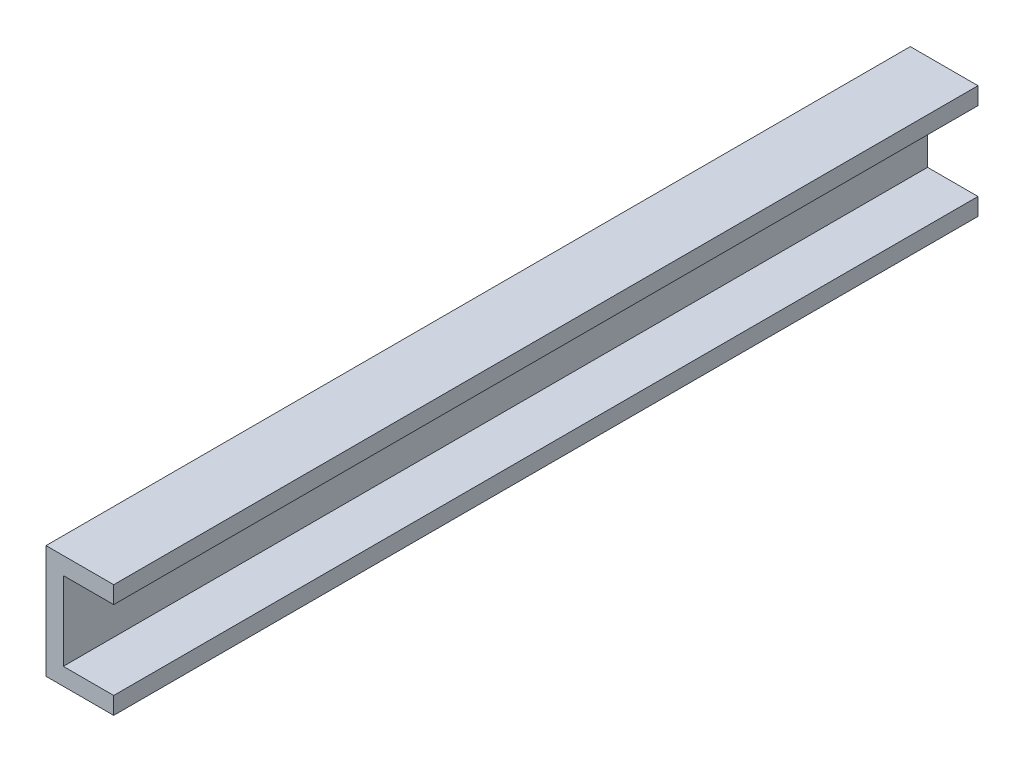
from build123d import *

# Parameters (mm, degrees)
BOSS_EXTRUDE1_DEPTH = 50


with BuildPart() as part:
    # Sketch1 → Boss-Extrude1 (new body)
    with BuildSketch(Plane.XY):
        Polygon((-12.982429164, -2.420723387), (-12.982429164, -1.420723387), (-15.899843623, -1.420723387), (-15.899843623, 3.129276613), (-12.982429164, 3.129276613), (-12.982429164, 4.129276613), (-16.899843623, 4.129276613), (-16.899843623, -2.420723387), align=None)
    extrude(amount=BOSS_EXTRUDE1_DEPTH)


solid = part.part
